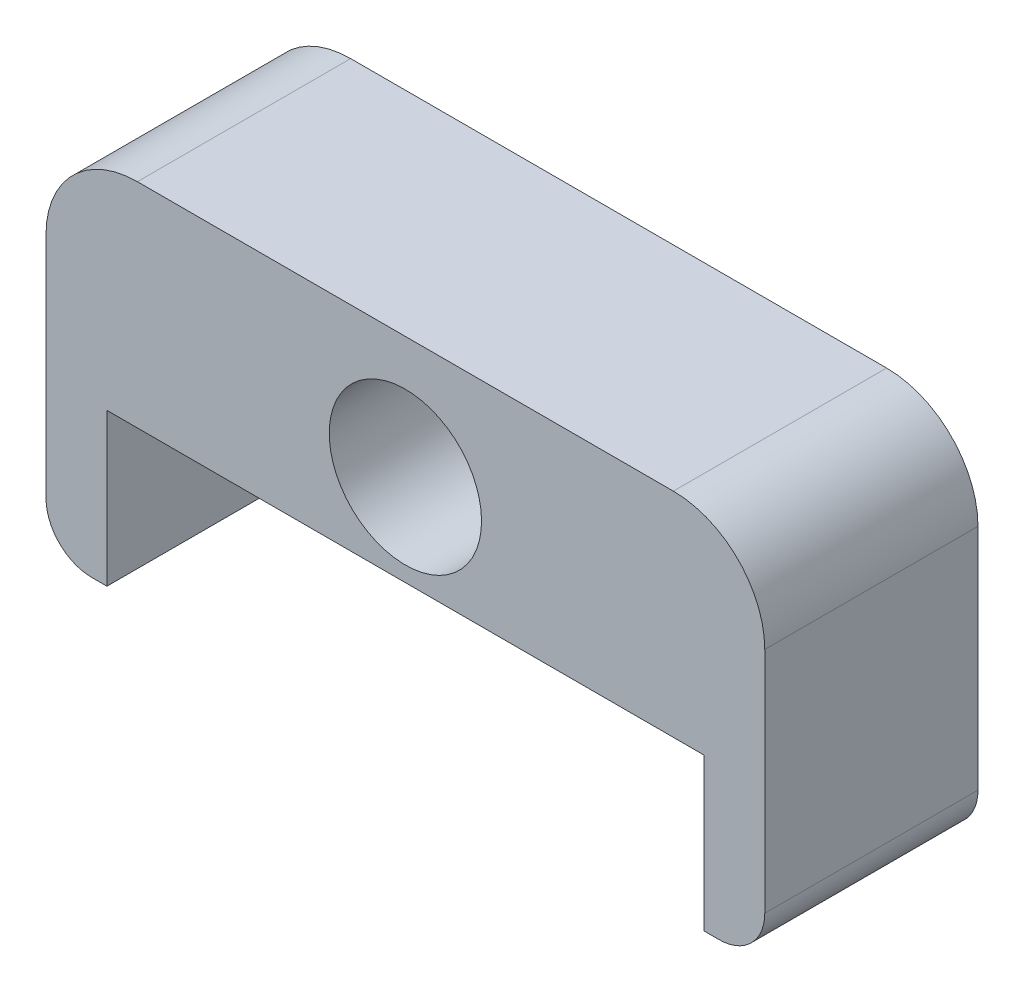
from build123d import *

# Parameters (mm, degrees)
BOSS_EXTRUDE1_DEPTH = 7
SKETCH5_R           = 2.5
CUT_EXTRUDE2_DEPTH  = 16.400080851
FILLET1_R           = 3
FILLET2_R           = 3
FILLET3_R           = 1.5
FILLET4_R           = 1.5


with BuildPart() as part:
    # Sketch1 → Boss-Extrude1 (new body)
    with BuildSketch(Plane.XY):
        Polygon((9.79671523, 0), (-9.79671523, 0), (-9.79671523, -5), (-11.79671523, -5), (-11.79671523, 7), (11.79671523, 7), (11.79671523, -5), (9.79671523, -5), align=None)
    extrude(amount=-BOSS_EXTRUDE1_DEPTH)

    # Sketch5 → Cut-Extrude2 (cut, through all)
    with BuildSketch(Plane.XY):
        with Locations((0, 3)):
            Circle(SKETCH5_R)
    extrude(amount=-CUT_EXTRUDE2_DEPTH, mode=Mode.SUBTRACT)

    # Fillet1
    fillet1_edges = [part.edges().sort_by_distance(p)[0] for p in [
        (11.79671523, 7, -3.5),
    ]]
    fillet(fillet1_edges, radius=FILLET1_R)

    # Fillet2
    fillet2_edges = [part.edges().sort_by_distance(p)[0] for p in [
        (-11.79671523, 7, -3.5),
    ]]
    fillet(fillet2_edges, radius=FILLET2_R)

    # Fillet3
    fillet3_edges = [part.edges().sort_by_distance(p)[0] for p in [
        (11.79671523, -5, -3.5),
    ]]
    fillet(fillet3_edges, radius=FILLET3_R)

    # Fillet4
    fillet4_edges = [part.edges().sort_by_distance(p)[0] for p in [
        (-11.79671523, -5, -3.5),
    ]]
    fillet(fillet4_edges, radius=FILLET4_R)


solid = part.part
